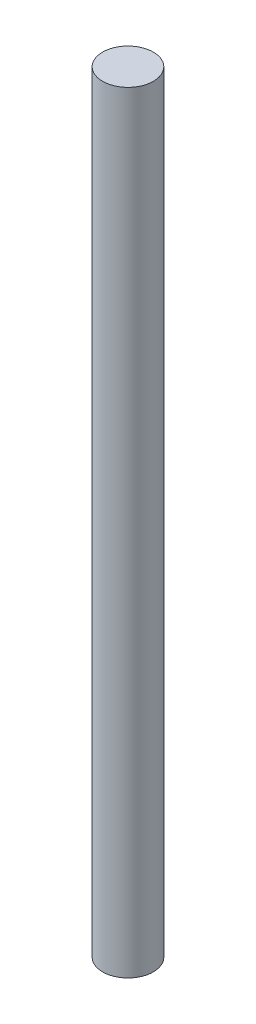
from build123d import *

# Parameters (mm, degrees)
SKETCH_1_R      = 11.5
EXTRUDE_1_DEPTH = 350


with BuildPart() as part:
    # 草圖1 → 填料-伸長1 (new body)
    with BuildSketch(Plane(origin=(0, 0, 0), x_dir=(1, 0, 0), z_dir=(0, 1, 0))):
        with Locations(Location((0, 0, 0), (0, 0, 270))):
            Circle(SKETCH_1_R)
    extrude(amount=EXTRUDE_1_DEPTH)


solid = part.part
